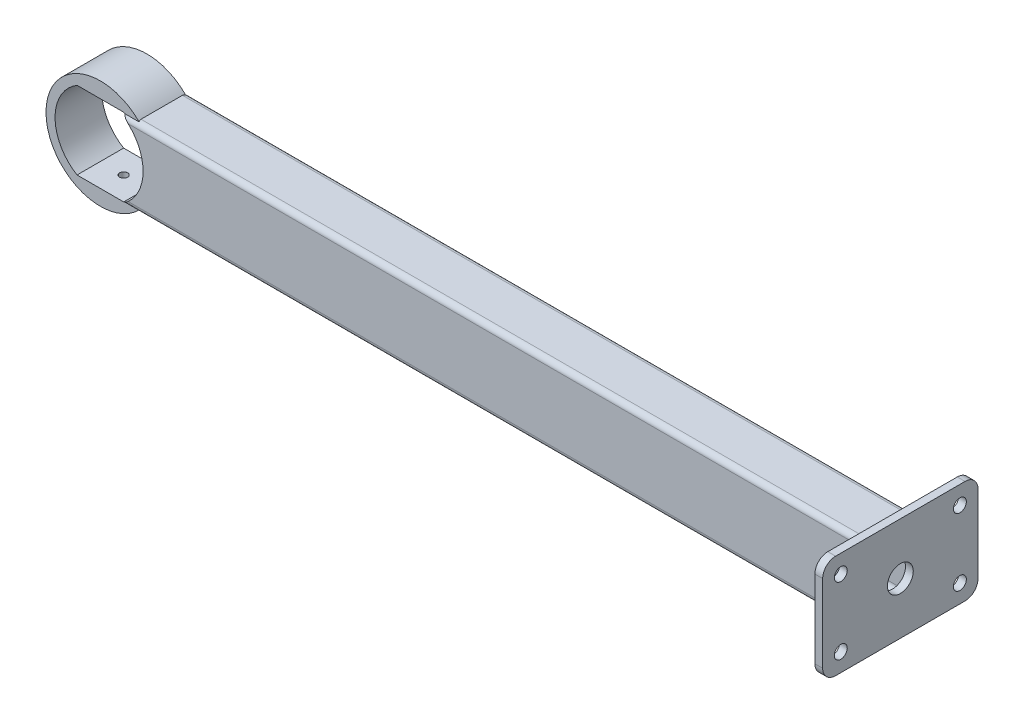
from build123d import *

# Parameters (mm, degrees)
BOSS_EXTRUDE1_DEPTH             = 300
SKETCH9_W                       = 60.00000000000001
SKETCH9_H                       = 40.00000000000001
SKETCH9_R                       = 5.000000000000005
SKETCH9_R_2                     = 2.5000000000000018
BOSS_EXTRUDE2_DEPTH             = 3
BOSS_EXTRUDE3_DEPTH             = 9
BOSS_EXTRUDE3_DEPTH_BACK        = 9
SKETCH10_R                      = 21
CUT_EXTRUDE1_DEPTH              = 19
CUT_EXTRUDE1_DEPTH_BACK         = 19
F_3_0MM_DOWEL_HOLE1_D           = 3
F_3_0MM_DOWEL_HOLE1_DEPTH       = 7.5
F_3_0MM_DOWEL_HOLE1_CSINK_D     = 3.05
F_3_0MM_DOWEL_HOLE1_CSINK_ANGLE = 90
F_3_0MM_DOWEL_HOLE1_TIP         = 0.9012909285413404
FILLET1_R                       = 5


with BuildPart() as part:
    # Sketch2 → Boss-Extrude1 (new body)
    with BuildSketch(Plane(origin=(0, 0, 0), x_dir=(0, 0, -1), z_dir=(1, 0, 0))):
        with BuildLine():
            Line((-7.999999999999989, 15), (7.999999999999983, 15))
            ThreePointArc((7.999999999999983, 15), (9.414213562373092, 14.414213562373094), (9.999999999999996, 12.999999999999986))
            Line((9.999999999999996, 12.999999999999986), (10, -12.999999999999986))
            ThreePointArc((10, -12.999999999999986), (9.414213562373096, -14.414213562373094), (7.999999999999987, -15))
            Line((7.999999999999987, -15), (-7.999999999999987, -15))
            ThreePointArc((-7.999999999999987, -15), (-9.414213562373096, -14.414213562373094), (-10, -12.999999999999986))
            Line((-10, -12.999999999999986), (-10.000000000000004, 12.999999999999986))
            ThreePointArc((-10.000000000000004, 12.999999999999986), (-9.4142135623731, 14.414213562373096), (-7.999999999999989, 15))
        make_face()
        with BuildLine():
            Line((-6.999999999999988, 13.999999999999996), (6.999999999999982, 13.999999999999996))
            ThreePointArc((6.999999999999982, 13.999999999999996), (8.41421356237309, 13.41421356237309), (8.999999999999996, 11.999999999999982))
            Line((8.999999999999996, 11.999999999999982), (9.000000000000002, -11.999999999999988))
            ThreePointArc((9.000000000000002, -11.999999999999988), (8.414213562373096, -13.414213562373098), (6.999999999999987, -14.000000000000002))
            Line((6.999999999999987, -14.000000000000002), (-6.999999999999984, -14.000000000000002))
            ThreePointArc((-6.999999999999984, -14.000000000000002), (-8.414213562373092, -13.414213562373096), (-8.999999999999998, -11.999999999999988))
            Line((-8.999999999999998, -11.999999999999988), (-9.000000000000004, 11.999999999999982))
            ThreePointArc((-9.000000000000004, 11.999999999999982), (-8.4142135623731, 13.414213562373092), (-6.999999999999988, 13.999999999999996))
        make_face(mode=Mode.SUBTRACT)
    extrude(amount=BOSS_EXTRUDE1_DEPTH)

    # Sketch9 → Boss-Extrude2 (add)
    with BuildSketch(Plane(origin=(300, 0, 0), x_dir=(0, 0, -1), z_dir=(1, 0, 0))):
        Rectangle(SKETCH9_W, SKETCH9_H)
        Circle(SKETCH9_R, mode=Mode.SUBTRACT)
        with Locations((-22.999999999999996, -13)):
            Circle(SKETCH9_R_2, mode=Mode.SUBTRACT)
        with Locations((-23, 13)):
            Circle(SKETCH9_R_2, mode=Mode.SUBTRACT)
        with Locations((22.999999999999996, -13)):
            Circle(SKETCH9_R_2, mode=Mode.SUBTRACT)
        with Locations((23, 13)):
            Circle(SKETCH9_R_2, mode=Mode.SUBTRACT)
    extrude(amount=-BOSS_EXTRUDE2_DEPTH)

    # Sketch10 → Boss-Extrude3 (add, two sides: drawn at the far end of the back side and taken through both)
    with BuildSketch(Plane.XY.offset(-BOSS_EXTRUDE3_DEPTH_BACK)):
        Circle(SKETCH10_R)
        with BuildLine():
            Line((9.013878188659977, -15.000000000000002), (-9.013878188659977, -15.000000000000002))
            ThreePointArc((-9.013878188659973, -15.000000000000004), (-17.500000000000004, -1.34e-14), (-9.013878188659987, 14.999999999999995))
            Line((-9.013878188659984, 14.999999999999996), (9.013878188659984, 14.999999999999996))
            ThreePointArc((9.013878188659984, 14.999999999999996), (17.500000000000004, -7.11e-15), (9.013878188659977, -15.000000000000004))
        make_face(mode=Mode.SUBTRACT)
    extrude(amount=BOSS_EXTRUDE3_DEPTH + BOSS_EXTRUDE3_DEPTH_BACK)

    # Sketch10<3> → Cut-Extrude1 (cut, two sides: drawn at the far end of the back side and taken through both)
    with BuildSketch(Plane.XY.offset(-CUT_EXTRUDE1_DEPTH_BACK)):
        with BuildLine():
            Line((-9.013878188659977, -15.000000000000002), (9.013878188659977, -15.000000000000002))
            ThreePointArc((9.013878188659966, -15.000000000000009), (15.231429156542559, -8.617050878881091), (17.500000000000004, -4.29e-15))
            ThreePointArc((17.500000000000004, 0), (15.231429156542566, 8.617050878881079), (9.013878188659985, 14.999999999999996))
            Line((9.013878188659984, 14.999999999999996), (-9.013878188659984, 14.999999999999996))
            ThreePointArc((-9.013878188659987, 14.999999999999995), (-17.500000000000004, -1.34e-14), (-9.013878188659973, -15.000000000000004))
        make_face()
    extrude(amount=CUT_EXTRUDE1_DEPTH + CUT_EXTRUDE1_DEPTH_BACK, mode=Mode.SUBTRACT)

    # Ø3.0mm Dowel Hole1
    with Locations(Plane(origin=(0, -15.000000000000002, 0), x_dir=(1, 0, 0), z_dir=(0, 1, 0))):
        with Locations((0, 0)):
            CounterSinkHole(F_3_0MM_DOWEL_HOLE1_D / 2, F_3_0MM_DOWEL_HOLE1_CSINK_D / 2, depth=F_3_0MM_DOWEL_HOLE1_DEPTH, counter_sink_angle=F_3_0MM_DOWEL_HOLE1_CSINK_ANGLE)
            with Locations((0, 0, -(F_3_0MM_DOWEL_HOLE1_DEPTH + F_3_0MM_DOWEL_HOLE1_TIP / 2))):  # 118° drill point
                Cone(0, F_3_0MM_DOWEL_HOLE1_D / 2, F_3_0MM_DOWEL_HOLE1_TIP, mode=Mode.SUBTRACT)

    # Fillet1
    fillet1_edges = [part.edges().sort_by_distance(p)[0] for p in [
        (298.5, 20.000000000000004, 30),
        (298.5, -20.000000000000004, 30),
        (298.5, -20.000000000000004, -30),
        (298.5, 20.000000000000004, -30),
    ]]
    fillet(fillet1_edges, radius=FILLET1_R)


solid = part.part
